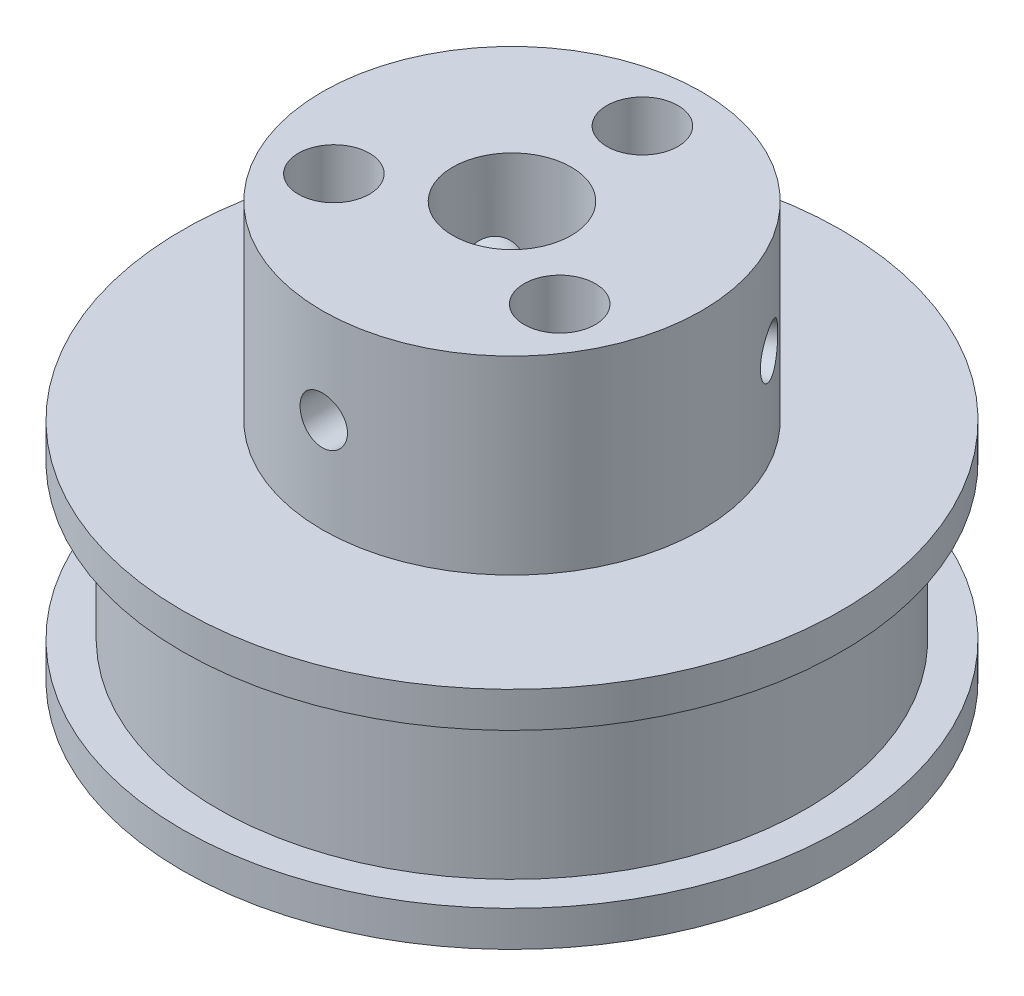
from build123d import *

# Parameters (mm, degrees)
ESQUISSE2_R             = 8.85
ESQUISSE2_R_2           = 8
ENL_V_MAT_EXTRU_1_DEPTH = 8
ESQUISSE3_R             = 1.5
ENL_V_MAT_EXTRU_2_DEPTH = 7
ESQUISSE4_R             = 1
ENL_V_MAT_EXTRU_3_DEPTH = 10
ESQUISSE6_R             = 1
ENL_V_MAT_EXTRU_4_DEPTH = 10
ESQUISSE7_R             = 1
ENL_V_MAT_EXTRU_5_DEPTH = 10


with BuildPart() as part:
    # Esquisse1 → Révolution1 (revolve)
    with BuildSketch(Plane.XY, mode=Mode.PRIVATE) as r_volution1_sk:
        Polygon((2.5, 0), (13.9, 0), (13.9, 1.5), (12.4, 1.5), (12.4, 8), (13.9, 8), (13.9, 9.5), (8.85, 9.5), (8.85, 17.5), (2.5, 17.5), align=None)
    revolve(r_volution1_sk.sketch.rotate(Axis((0, 0, 0), (0, 1, 0)), 90), axis=Axis((0, 0, 0), (0, 1, 0)))

    # Esquisse2 → Enlèv. mat.-Extru.1 (cut)
    with BuildSketch(Plane(origin=(0, 17.5, 0), x_dir=(1, 0, 0), z_dir=(0, 1, 0))):
        Circle(ESQUISSE2_R)
        with Locations(Location((0, 0, 0), (0, 0, 270))):
            Circle(ESQUISSE2_R_2, mode=Mode.SUBTRACT)
    extrude(amount=-ENL_V_MAT_EXTRU_1_DEPTH, mode=Mode.SUBTRACT)

    # Esquisse3 → Enlèv. mat.-Extru.2 (cut)
    with BuildSketch(Plane(origin=(0, 17.5, 0), x_dir=(1, 0, 0), z_dir=(0, 1, 0))):
        with Locations(Location((0, 5.5, 0), (0, 0, 270))):
            Circle(ESQUISSE3_R)
        with Locations(Location((4.763139721, -2.75, 0), (0, 0, 270))):
            Circle(ESQUISSE3_R)
        with Locations(Location((-4.763139721, -2.75, 0), (0, 0, 270))):
            Circle(ESQUISSE3_R)
    extrude(amount=-ENL_V_MAT_EXTRU_2_DEPTH, mode=Mode.SUBTRACT)

    # Esquisse4 → Enlèv. mat.-Extru.3 (cut)
    with BuildSketch(Plane.XY):
        with Locations(Location((0, 13.5, 0), (0, 0, 180))):
            Circle(ESQUISSE4_R)
    extrude(amount=ENL_V_MAT_EXTRU_3_DEPTH, mode=Mode.SUBTRACT)

    # Esquisse6 → Enlèv. mat.-Extru.4 (cut)
    with BuildSketch(Plane(origin=(0, 0, 0), x_dir=(0, 1, 0), z_dir=(0.8660254037844398, 0, 0.499999999999998))):
        with Locations(Location((13.499909745, 0, 0), (0, 0, 270))):
            Circle(ESQUISSE6_R)
    extrude(amount=-ENL_V_MAT_EXTRU_4_DEPTH, mode=Mode.SUBTRACT)

    # Esquisse7 → Enlèv. mat.-Extru.5 (cut)
    with BuildSketch(Plane(origin=(0, 0, 0), x_dir=(0, 1, 0), z_dir=(0.8660254037844364, 0, -0.500000000000004))):
        with Locations(Location((13.5, 0, 0), (0, 0, 90))):
            Circle(ESQUISSE7_R)
    extrude(amount=ENL_V_MAT_EXTRU_5_DEPTH, mode=Mode.SUBTRACT)


solid = part.part
